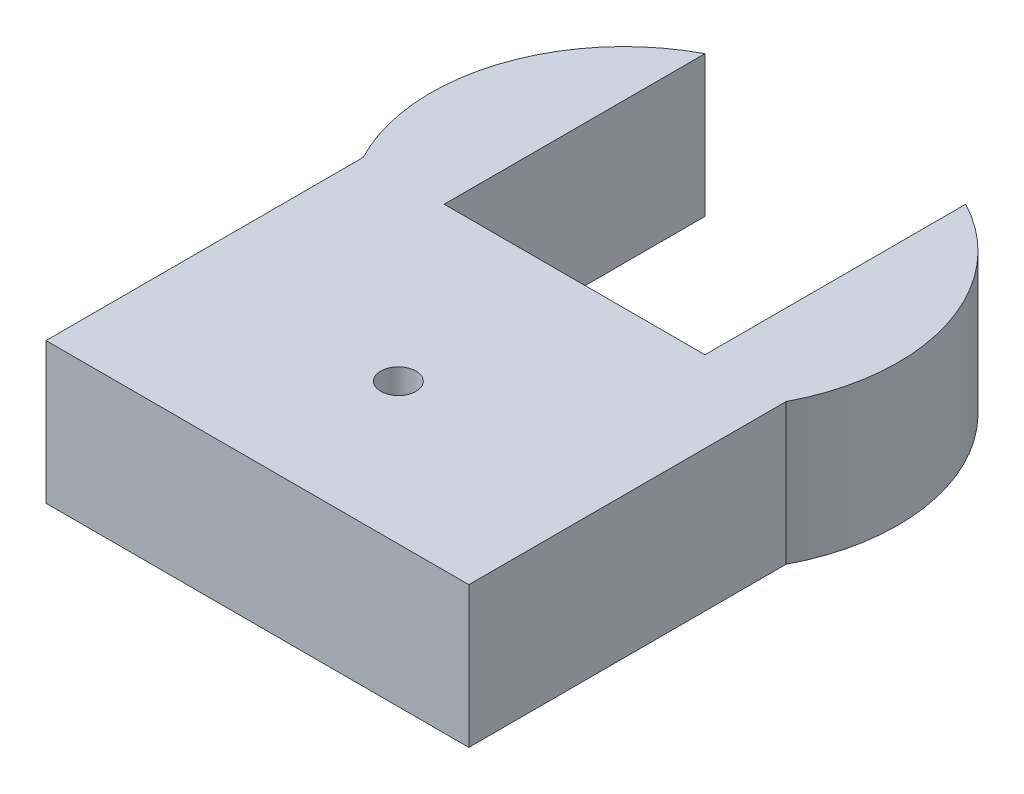
from build123d import *

# Parameters (mm, degrees)
BOSS_EXTRUDE1_DEPTH = 20
SKETCH2_R           = 2.5
CUT_EXTRUDE1_DEPTH  = 20


with BuildPart() as part:
    # Sketch1 → Boss-Extrude1 (new body)
    with BuildSketch(Plane(origin=(0, 0, 0), x_dir=(1, 0, 0), z_dir=(0, 1, 0))):
        with BuildLine():
            Line((-19.801702617, 0), (17.198297383, 0))
            Line((17.198297383, 0), (17.198297383, 37))
            ThreePointArc((17.198297383, 37), (30.611248287, 20.881727984), (28.698297383, 0))
            Line((28.698297383, 0), (28.698297383, -45))
            Line((28.698297383, -45), (-31.301702617, -45))
            Line((-31.301702617, -45), (-31.301702617, 0))
            ThreePointArc((-31.301702617, 0), (-33.214653521, 20.881727984), (-19.801702617, 37))
            Line((-19.801702617, 37), (-19.801702617, 0))
        make_face()
    extrude(amount=BOSS_EXTRUDE1_DEPTH)

    # Sketch2 → Cut-Extrude1 (cut)
    with BuildSketch(Plane(origin=(0, 20, 0), x_dir=(1, 0, 0), z_dir=(0, 1, 0))):
        with Locations(Location((-1.301702617, -25, 0), (0, 0, 270))):
            Circle(SKETCH2_R)
    extrude(amount=-CUT_EXTRUDE1_DEPTH, mode=Mode.SUBTRACT)


solid = part.part
